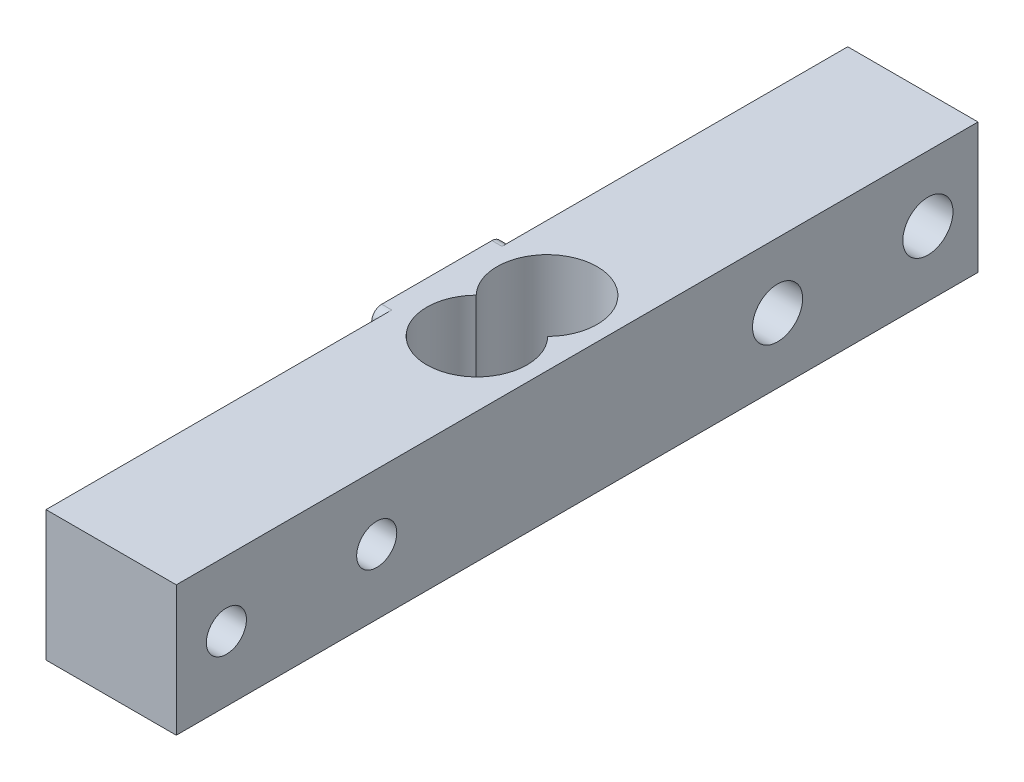
from build123d import *

# Parameters (mm, degrees)
SKETCH1_W           = 13
SKETCH1_H           = 13
BOSS_EXTRUDE1_DEPTH = 40
CUT_EXTRUDE1_DEPTH  = 43.558782877
SKETCH3_R           = 2
SKETCH3_R_2         = 2.5
CUT_EXTRUDE2_DEPTH  = 43.558782877
SKETCH5_W           = 13
SKETCH5_H           = 13
BOSS_EXTRUDE2_DEPTH = 1
FILLET1_R           = 1


with BuildPart() as part:
    # Sketch1 → Boss-Extrude1 (new, symmetric)
    with BuildSketch(Plane.XY):
        Rectangle(SKETCH1_W, SKETCH1_H)
    extrude(amount=BOSS_EXTRUDE1_DEPTH, both=True)

    # Sketch2 → Cut-Extrude1 (cut, through all)
    with BuildSketch(Plane(origin=(0, 6.5, 0), x_dir=(1, 0, 0), z_dir=(0, 1, 0))):
        with BuildLine():
            ThreePointArc((3.570714214, 0), (0, 8.5), (-3.570714214, 0))
            ThreePointArc((-3.570714214, 0), (0, -8.5), (3.570714214, 0))
        make_face()
    extrude(amount=-CUT_EXTRUDE1_DEPTH, mode=Mode.SUBTRACT)

    # Sketch3 → Cut-Extrude2 (cut, through all)
    with BuildSketch(Plane(origin=(6.5, 0, 0), x_dir=(0, 0, -1), z_dir=(1, 0, 0))):
        with Locations((-35, 0)):
            Circle(SKETCH3_R)
        with Locations((-20, 0)):
            Circle(SKETCH3_R)
        with Locations((20, 0)):
            Circle(SKETCH3_R_2)
        with Locations((35, 0)):
            Circle(SKETCH3_R_2)
    extrude(amount=-CUT_EXTRUDE2_DEPTH, mode=Mode.SUBTRACT)

    # Sketch5 → Boss-Extrude2 (add)
    with BuildSketch(Plane.ZY.offset(6.5)):
        Rectangle(SKETCH5_W, SKETCH5_H)
    extrude(amount=BOSS_EXTRUDE2_DEPTH)

    # Fillet1
    fillet1_edges = [part.edges().sort_by_distance(p)[0] for p in [
        (-7, -6.5, 6.5),
        (-7, 6.5, 6.5),
        (-7, 6.5, -6.5),
        (-7, -6.5, -6.5),
    ]]
    fillet(fillet1_edges, radius=FILLET1_R)


solid = part.part
